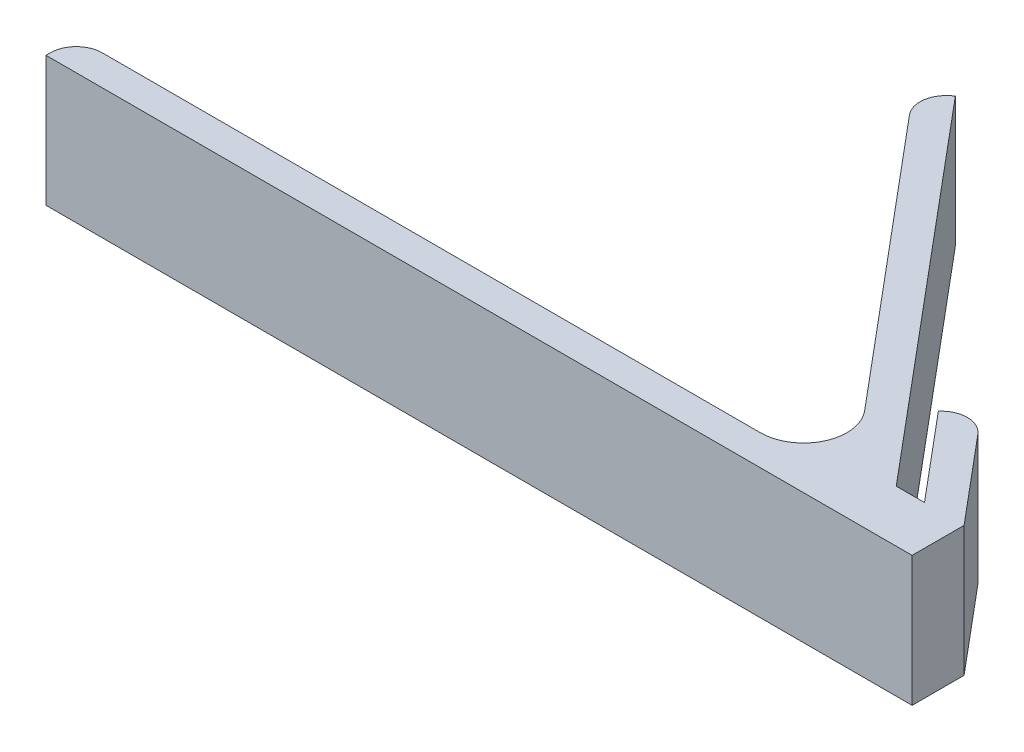
from build123d import *

# Parameters (mm, degrees)
BOSS_EXTRUDE1_DEPTH = 15
FILLET1_R           = 3


with BuildPart() as part:
    # Sketch1 → Boss-Extrude1 (new body)
    with BuildSketch(Plane(origin=(0, 0, 0), x_dir=(1, 0, 0), z_dir=(0, 1, 0))):
        with BuildLine():
            Line((-46.121374994, 46.185937989), (-17.195932558, 11.713938048))
            ThreePointArc((-17.195932558, 11.713938048), (-16.494615838, 6.386908691), (-21.026154773, 3.5))
            Line((-21.026154773, 3.5), (-100, 3.5))
            Line((-100, 3.5), (-100, 0))
            Line((-100, 0), (0, 0))
            Line((0, 0), (0, 6))
            Line((0, 6), (-10.244008888, 18.208334394))
            Line((-10.244008888, 18.208334394), (-12.925164439, 15.958577761))
            Line((-12.925164439, 15.958577761), (-4.568925513, 6))
            Line((-4.568925513, 6), (-7.832443736, 6))
            Line((-7.832443736, 6), (-43.440219443, 48.435694623))
            Line((-43.440219443, 48.435694623), (-46.121374994, 46.185937989))
        make_face()
    extrude(amount=BOSS_EXTRUDE1_DEPTH)

    # Fillet1
    fillet1_edges = [part.edges().sort_by_distance(p)[0] for p in [
        (-10.244008888, 7.5, -18.208334394),
        (-100, 7.5, -3.5),
        (-46.121374994, 7.5, -46.185937989),
    ]]
    fillet(fillet1_edges, radius=FILLET1_R)


solid = part.part
